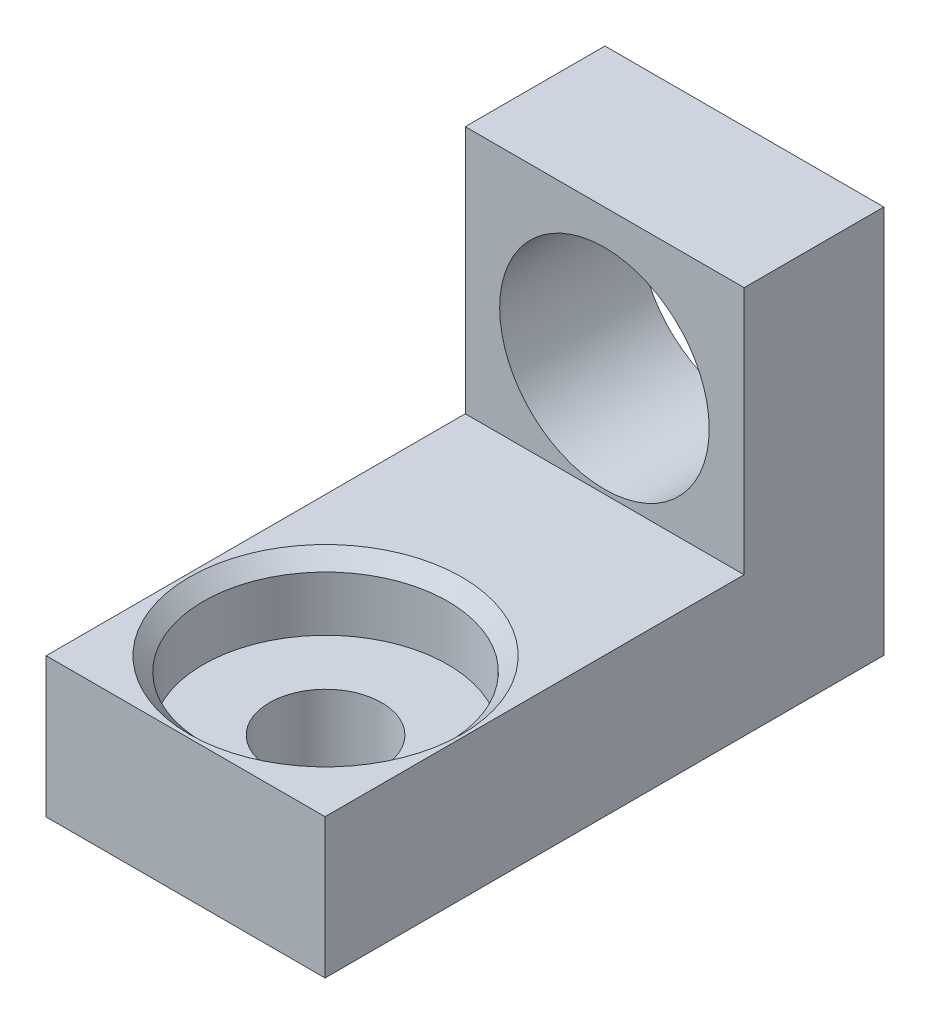
from build123d import *

# Parameters (mm, degrees)
SKETCH1_R           = 4.7625
BOSS_EXTRUDE1_DEPTH = 6.35
SKETCH2_W           = 12.676867833
SKETCH2_H           = 6.35
BOSS_EXTRUDE2_DEPTH = 19.05


with BuildPart() as part:
    # Sketch1 → Boss-Extrude1 (new body)
    with BuildSketch(Plane.XY):
        Polygon((-6.326867833, 0), (-6.326867833, -11.303), (6.35, -11.303), (6.35, 0), (6.35, 6.35), (-6.326867833, 6.35), align=None)
        Circle(SKETCH1_R, mode=Mode.SUBTRACT)
    extrude(amount=BOSS_EXTRUDE1_DEPTH)

    # Sketch2 → Boss-Extrude2 (add)
    with BuildSketch(Plane.XY.offset(6.35)):
        with Locations((0.011566083, -8.128)):
            Rectangle(SKETCH2_W, SKETCH2_H)
    extrude(amount=BOSS_EXTRUDE2_DEPTH)

    # Sketch7 → CBORE for #10 Binding Head Machine Screw1 (revolve, cut)
    with BuildSketch(Plane(origin=(0.023132167, -4.953, 19.05), x_dir=(0, 0, 1), z_dir=(1, 0, 0))):
        Polygon((0, 0), (0, 6.35), (2.5527, 6.35), (2.5527, 3.1242), (5.55625, 3.1242), (5.55625, 0.635), (6.19125, 0), align=None)
    revolve(axis=Axis((0.023132167, 1.397, 19.05), (0, -1, 0)), mode=Mode.SUBTRACT)


solid = part.part
